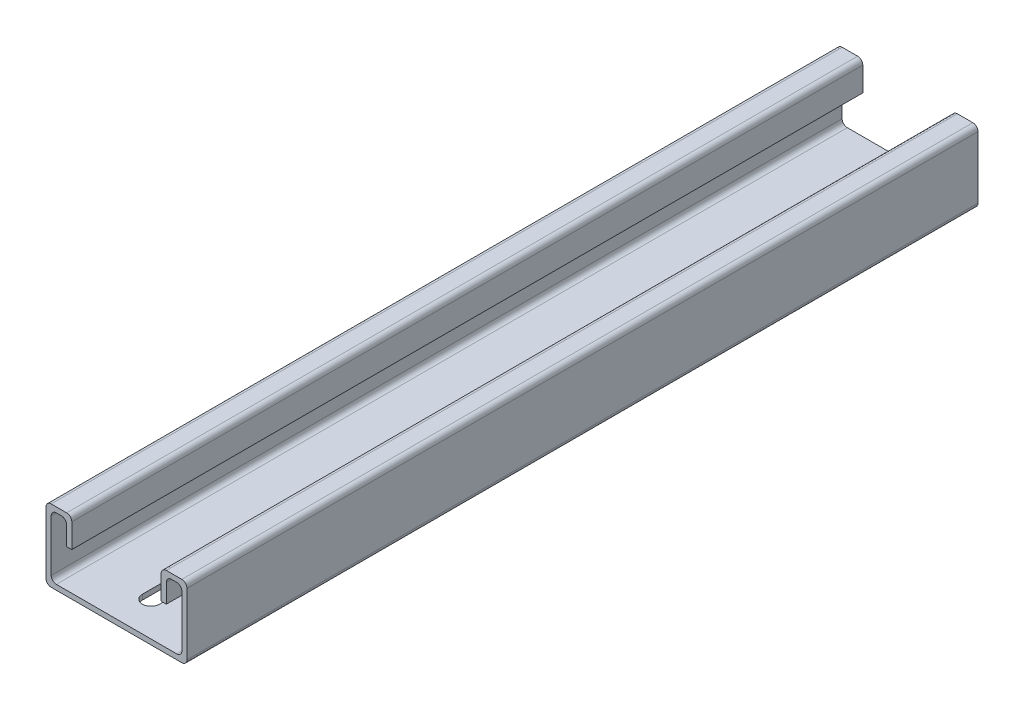
from build123d import *

# Parameters (mm, degrees)
EXTRUDE_1_DEPTH     = 230
CUT_EXTRUDE_1_DEPTH = 100


with BuildPart() as part:
    # 草图1 → 凸台-拉伸1 (new body)
    with BuildSketch(Plane.XY):
        with BuildLine():
            Line((-19, 10.5), (-14.5, 10.5))
            ThreePointArc((-14.5, 10.5), (-13.439339828, 10.060660172), (-13, 9))
            Line((-13, 9), (-13, 2))
            Line((-13, 2), (-14.5, 2))
            Line((-14.5, 2), (-14.5, 7.5))
            ThreePointArc((-14.5, 7.5), (-14.939339828, 8.560660172), (-16, 9))
            Line((-16, 9), (-17.5, 9))
            ThreePointArc((-17.5, 9), (-18.560660172, 8.560660172), (-19, 7.5))
            Line((-19, 7.5), (-19, -7.5))
            ThreePointArc((-19, -7.5), (-18.560660172, -8.560660172), (-17.5, -9))
            Line((-17.5, -9), (17.5, -9))
            ThreePointArc((17.5, -9), (18.560660172, -8.560660172), (19, -7.5))
            Line((19, -7.5), (19, 7.5))
            ThreePointArc((19, 7.5), (18.560660172, 8.560660172), (17.5, 9))
            Line((17.5, 9), (16, 9))
            ThreePointArc((16, 9), (14.939339828, 8.560660172), (14.5, 7.5))
            Line((14.5, 7.5), (14.5, 2))
            Line((14.5, 2), (13, 2))
            Line((13, 2), (13, 9))
            ThreePointArc((13, 9), (13.439339828, 10.060660172), (14.5, 10.5))
            Line((14.5, 10.5), (19, 10.5))
            ThreePointArc((19, 10.5), (20.060660172, 10.060660172), (20.5, 9))
            Line((20.5, 9), (20.5, -9))
            ThreePointArc((20.5, -9), (20.060660172, -10.060660172), (19, -10.5))
            Line((19, -10.5), (-19, -10.5))
            ThreePointArc((-19, -10.5), (-20.060660172, -10.060660172), (-20.5, -9))
            Line((-20.5, -9), (-20.5, 9))
            ThreePointArc((-20.5, 9), (-20.060660172, 10.060660172), (-19, 10.5))
        make_face()
    extrude(amount=EXTRUDE_1_DEPTH)

    # 草图3 → 切除-拉伸1 (cut)
    with BuildSketch(Plane(origin=(0, 0, 0), x_dir=(1, 0, 0), z_dir=(0, 1, 0))):
        with BuildLine():
            Line((2.5, -10), (2.5, -220))
            ThreePointArc((2.5, -220), (0, -222.5), (-2.5, -220))
            Line((-2.5, -220), (-2.5, -10))
            ThreePointArc((-2.5, -10), (0, -7.5), (2.5, -10))
        make_face()
    extrude(amount=-CUT_EXTRUDE_1_DEPTH, mode=Mode.SUBTRACT)


solid = part.part
